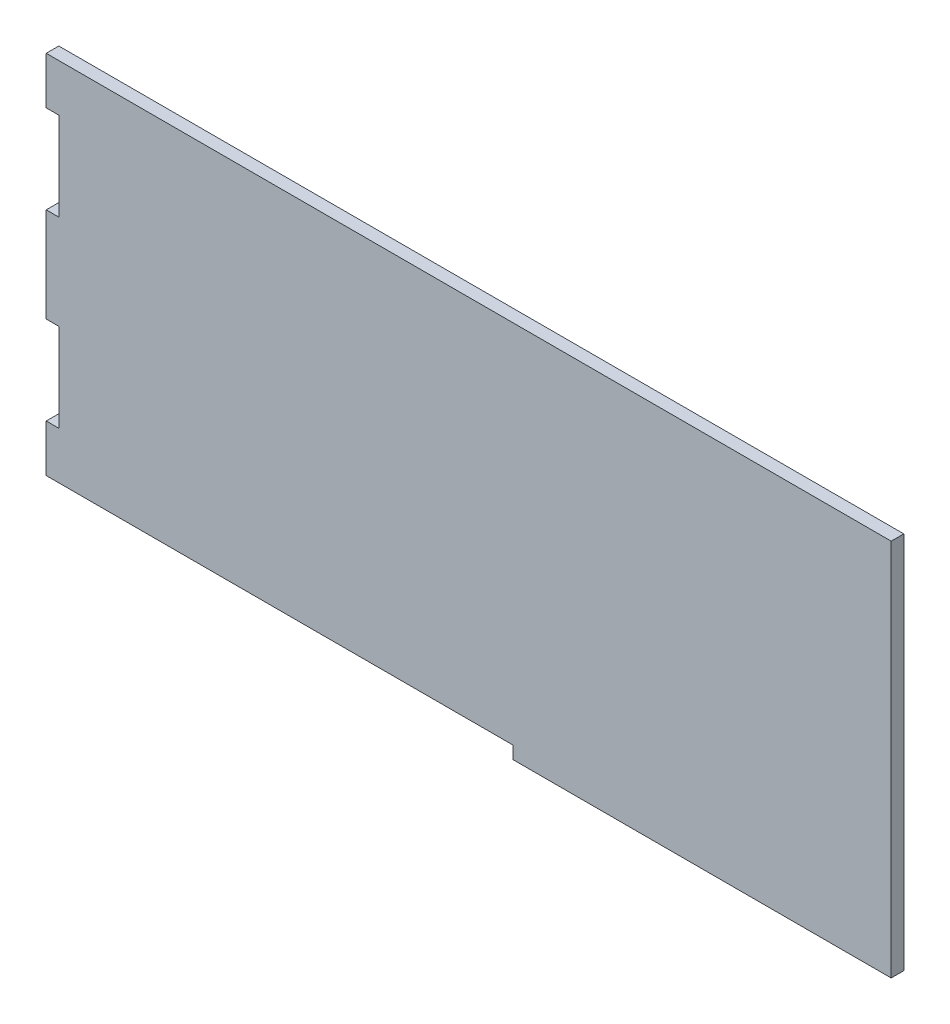
from build123d import *

# Parameters (mm, degrees)
SALIENTE_EXTRUIR1_DEPTH = 5
CROQUIS2_W              = 5
CROQUIS2_H              = 35
CORTAR_EXTRUIR1_DEPTH   = 5
CORTAR_EXTRUIR2_DEPTH   = 10
CORTAR_EXTRUIR4_DEPTH   = 10


with BuildPart() as part:
    # Croquis1 → Saliente-Extruir1 (new body)
    with BuildSketch(Plane.XY):
        Polygon((0, 145), (0, 0), (183.734642654, 0), (185, 0), (185, -5), (485, -5), (485, 0), (670, 0), (670, -5), (970, -5), (970, 0), (1155, 0), (1155, -5), (1455, -5), (1455, 0), (1640, 0), (1640, 145), align=None)
    extrude(amount=SALIENTE_EXTRUIR1_DEPTH)

    # Croquis2 → Cortar-Extruir1 (cut)
    with BuildSketch(Plane.XY.offset(5)):
        with Locations((1637.5, 108.75)):
            Rectangle(CROQUIS2_W, CROQUIS2_H)
        with Locations((1637.5, 36.25)):
            Rectangle(CROQUIS2_W, CROQUIS2_H)
        with Locations((2.5, 36.25)):
            Rectangle(CROQUIS2_W, CROQUIS2_H)
        with Locations((2.5, 108.75)):
            Rectangle(CROQUIS2_W, CROQUIS2_H)
    extrude(amount=-CORTAR_EXTRUIR1_DEPTH, mode=Mode.SUBTRACT)

    # Croquis3 → Cortar-Extruir2 (cut)
    with BuildSketch(Plane.XY.offset(5)):
        Polygon((579.3, 0), (575.7, 0), (575.7, 5), (573.9, 5), (573.9, 8.2), (575.7, 8.2), (575.7, 17.2), (579.3, 17.2), (579.3, 8.2), (581.1, 8.2), (581.1, 5), (579.3, 5), align=None)
        Polygon((1064.3, 8.2), (1064.3, 17.2), (1060.7, 17.2), (1060.7, 8.2), (1058.9, 8.2), (1058.9, 5), (1060.7, 5), (1060.7, 0), (1064.3, 0), (1064.3, 5), (1066.1, 5), (1066.1, 8.2), align=None)
    extrude(amount=-CORTAR_EXTRUIR2_DEPTH, mode=Mode.SUBTRACT)

    # Croquis4 → Cortar-Extruir4 (cut)
    with BuildSketch(Plane.XY.offset(5)):
        Polygon((335, -5), (335, 145), (1640, 145), (1671.122374821, -141.538372297), (335, -87.56268072), align=None)
    extrude(amount=-CORTAR_EXTRUIR4_DEPTH, mode=Mode.SUBTRACT)


solid = part.part
